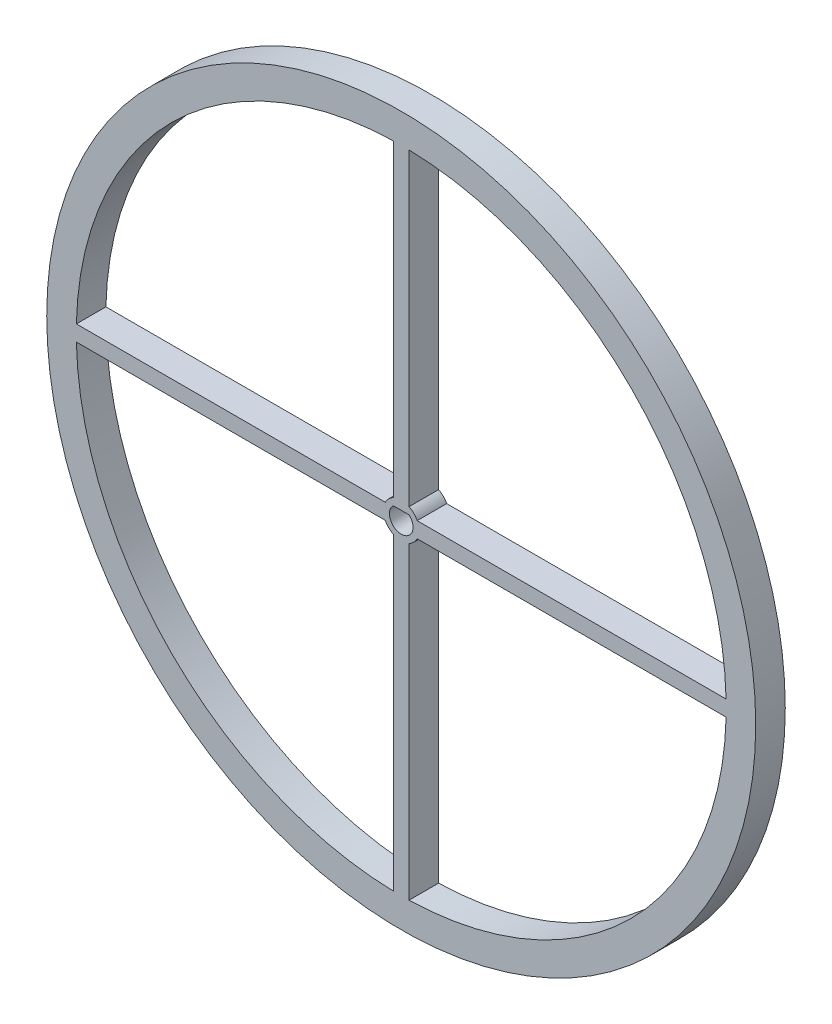
from build123d import *

# Parameters (mm, degrees)
SKETCH1_R           = 60
SKETCH1_R_2         = 3
BOSS_EXTRUDE2_DEPTH = 5


with BuildPart() as part:
    # Sketch1 → Boss-Extrude2 (new body)
    # profile 1 of 2: a face of its own
    with BuildSketch(Plane.XY):
        Circle(SKETCH1_R)
        with BuildLine():
            Line((-1.325, 54.984037456), (-1.325, 2.691537665))
            ThreePointArc((-1.325, 2.691537665), (0, 3), (1.325, 2.691537665))
            Line((1.325, 2.691537665), (1.325, 54.984037456))
            ThreePointArc((1.325, 54.984037456), (38.890872965, 38.890872965), (54.984037456, 1.325))
            Line((54.984037456, 1.325), (2.691537665, 1.325))
            ThreePointArc((2.691537665, 1.325), (2.921866954, 0.680215777), (3, 0))
            ThreePointArc((3, 0), (2.921866954, -0.680215777), (2.691537665, -1.325))
            Line((2.691537665, -1.325), (54.984037456, -1.325))
            ThreePointArc((54.984037456, -1.325), (38.890872965, -38.890872965), (1.325, -54.984037456))
            Line((1.325, -54.984037456), (1.325, -2.691537665))
            ThreePointArc((1.325, -2.691537665), (0, -3), (-1.325, -2.691537665))
            Line((-1.325, -2.691537665), (-1.325, -54.984037456))
            ThreePointArc((-1.325, -54.984037456), (-38.890872965, -38.890872965), (-54.984037456, -1.325))
            Line((-54.984037456, -1.325), (-2.691537665, -1.325))
            ThreePointArc((-2.691537665, -1.325), (-3, 0), (-2.691537665, 1.325))
            Line((-2.691537665, 1.325), (-54.984037456, 1.325))
            ThreePointArc((-54.984037456, 1.325), (-38.890872965, 38.890872965), (-1.325, 54.984037456))
        make_face(mode=Mode.SUBTRACT)
    # profile 2 of 2: a face of its own
    with BuildSketch(Plane.XY):
        Circle(SKETCH1_R_2)
        with BuildLine():
            ThreePointArc((-1.325, 1.498123827), (0, -2), (1.325, 1.498123827))
            Line((1.325, 1.498123827), (-1.325, 1.498123827))
        make_face(mode=Mode.SUBTRACT)
    extrude(amount=BOSS_EXTRUDE2_DEPTH)


solid = part.part
